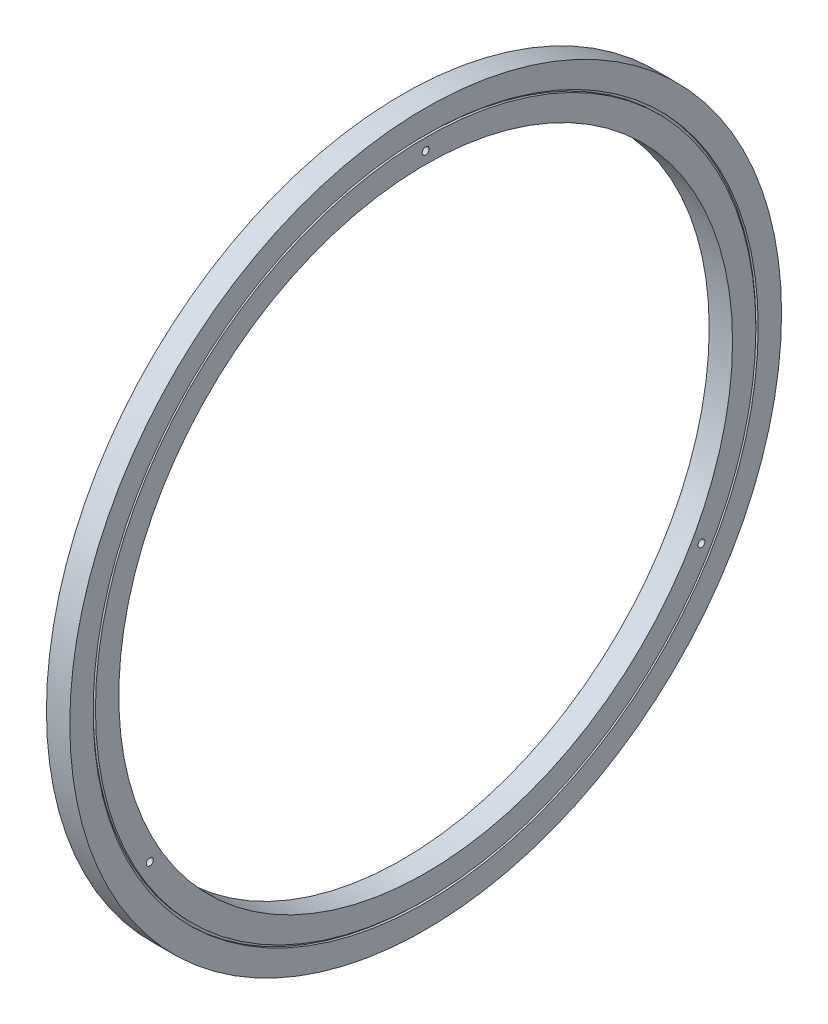
from build123d import *

# Parameters (mm, degrees)
SKETCH1_R             = 152.5
SKETCH1_R_2           = 142.5
BOSS_EXTRUDE2_DEPTH   = 5
SKETCH1_R_3           = 141.5
SKETCH1_R_4           = 131.5
BOSS_EXTRUDE2_2_DEPTH = 5
SKETCH1_4_R           = 142.5
SKETCH1_4_R_2         = 141.5
BOSS_EXTRUDE3_DEPTH   = 4
SKETCH2_R             = 1.5
CUT_EXTRUDE1_DEPTH    = 4


with BuildPart() as part:
    # Sketch1 → Boss-Extrude2 (new, symmetric)
    with BuildSketch(Plane(origin=(0, 0, 0), x_dir=(0, 0, -1), z_dir=(1, 0, 0))):
        Circle(SKETCH1_R)
        Circle(SKETCH1_R_2, mode=Mode.SUBTRACT)
    extrude(amount=BOSS_EXTRUDE2_DEPTH, both=True)



with BuildPart() as body_2:
    # Sketch1 → Boss-Extrude2 2 (new, symmetric)
    with BuildSketch(Plane(origin=(0, 0, 0), x_dir=(0, 0, -1), z_dir=(1, 0, 0))):
        Circle(SKETCH1_R_3)
        Circle(SKETCH1_R_4, mode=Mode.SUBTRACT)
    extrude(amount=BOSS_EXTRUDE2_2_DEPTH, both=True)


with BuildPart() as part_1:
    add(part.part)

    add(body_2.part)  # Boss-Extrude3 merges body 2
    # Sketch1<4> → Boss-Extrude3 (add, symmetric)
    with BuildSketch(Plane(origin=(0, 0, 0), x_dir=(0, 0, -1), z_dir=(1, 0, 0))):
        Circle(SKETCH1_4_R)
        Circle(SKETCH1_4_R_2, mode=Mode.SUBTRACT)
    extrude(amount=BOSS_EXTRUDE3_DEPTH, both=True)

    # Sketch2 → Cut-Extrude1 (cut)
    with BuildSketch(Plane(origin=(5, 0, 0), x_dir=(0, 0, -1), z_dir=(1, 0, 0))):
        with Locations((0, 136.5)):
            Circle(SKETCH2_R)
        with Locations((118.212467617, -68.25)):
            Circle(SKETCH2_R)
        with Locations((-118.212467617, -68.25)):
            Circle(SKETCH2_R)
    extrude(amount=-CUT_EXTRUDE1_DEPTH, mode=Mode.SUBTRACT)


solid = part_1.part
